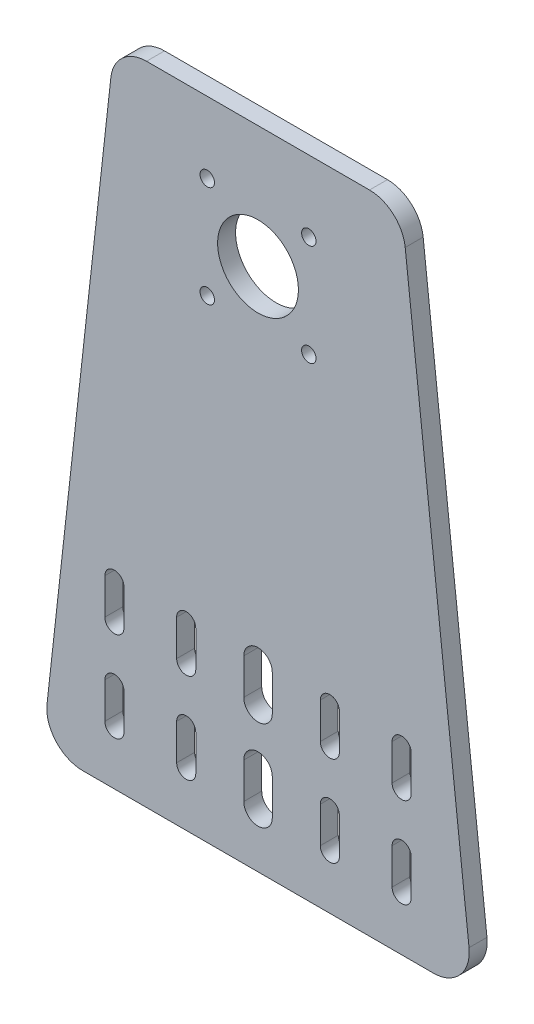
from build123d import *

# Parameters (mm, degrees)
SKETCH1_R           = 14.2875
SKETCH1_R_2         = 2.5527
BOSS_EXTRUDE1_DEPTH = 6.35


with BuildPart() as part:
    # Sketch1 → Boss-Extrude1 (new body)
    with BuildSketch(Plane.XY):
        with BuildLine():
            Line((14.189265695, 0), (138.210734305, 0))
            ThreePointArc((138.210734305, 0), (147.673860132, 4.230097428), (150.833057735, 14.102480381))
            Line((150.833057735, 14.102480381), (128.255279958, 217.302480381))
            ThreePointArc((128.255279958, 217.302480381), (124.102859099, 225.363125827), (115.632956527, 228.6))
            Line((115.632956527, 228.6), (36.767043473, 228.6))
            ThreePointArc((36.767043473, 228.6), (28.297140901, 225.363125827), (24.144720042, 217.302480381))
            Line((24.144720042, 217.302480381), (1.566942265, 14.102480381))
            ThreePointArc((1.566942265, 14.102480381), (4.726139868, 4.230097428), (14.189265695, 0))
        make_face()
        with Locations((76.2, 185.4708)):
            Circle(SKETCH1_R, mode=Mode.SUBTRACT)
        with Locations((94.160512242, 203.431312242)):
            Circle(SKETCH1_R_2, mode=Mode.SUBTRACT)
        with Locations((94.160512242, 167.510287758)):
            Circle(SKETCH1_R_2, mode=Mode.SUBTRACT)
        with Locations((58.239487758, 167.510287758)):
            Circle(SKETCH1_R_2, mode=Mode.SUBTRACT)
        with Locations((58.239487758, 203.431312242)):
            Circle(SKETCH1_R_2, mode=Mode.SUBTRACT)
        with BuildLine():
            Line((98.2218, 19.05), (98.2218, 31.75))
            ThreePointArc((98.2218, 31.75), (101.6, 35.1282), (104.9782, 31.75))
            Line((104.9782, 31.75), (104.9782, 19.05))
            ThreePointArc((104.9782, 19.05), (101.6, 15.6718), (98.2218, 19.05))
        make_face(mode=Mode.SUBTRACT)
        with BuildLine():
            Line((71.1581, 19.05), (71.1581, 31.75))
            ThreePointArc((71.1581, 31.75), (76.2, 36.7919), (81.2419, 31.75))
            Line((81.2419, 31.75), (81.2419, 19.05))
            ThreePointArc((81.2419, 19.05), (76.2, 14.0081), (71.1581, 19.05))
        make_face(mode=Mode.SUBTRACT)
        with BuildLine():
            Line((130.3782, 19.05), (130.3782, 31.75))
            ThreePointArc((130.3782, 31.75), (127, 35.1282), (123.6218, 31.75))
            Line((123.6218, 31.75), (123.6218, 19.05))
            ThreePointArc((123.6218, 19.05), (127, 15.6718), (130.3782, 19.05))
        make_face(mode=Mode.SUBTRACT)
        with BuildLine():
            Line((54.1782, 19.05), (54.1782, 31.75))
            ThreePointArc((54.1782, 31.75), (50.8, 35.1282), (47.4218, 31.75))
            Line((47.4218, 31.75), (47.4218, 19.05))
            ThreePointArc((47.4218, 19.05), (50.8, 15.6718), (54.1782, 19.05))
        make_face(mode=Mode.SUBTRACT)
        with BuildLine():
            Line((28.7782, 19.05), (28.7782, 31.75))
            ThreePointArc((28.7782, 31.75), (25.4, 35.1282), (22.0218, 31.75))
            Line((22.0218, 31.75), (22.0218, 19.05))
            ThreePointArc((22.0218, 19.05), (25.4, 15.6718), (28.7782, 19.05))
        make_face(mode=Mode.SUBTRACT)
        with BuildLine():
            Line((28.7782, 50.9524), (28.7782, 63.6524))
            ThreePointArc((28.7782, 63.6524), (25.4, 67.0306), (22.0218, 63.6524))
            Line((22.0218, 63.6524), (22.0218, 50.9524))
            ThreePointArc((22.0218, 50.9524), (25.4, 47.5742), (28.7782, 50.9524))
        make_face(mode=Mode.SUBTRACT)
        with BuildLine():
            Line((54.1782, 50.9524), (54.1782, 63.6524))
            ThreePointArc((54.1782, 63.6524), (50.8, 67.0306), (47.4218, 63.6524))
            Line((47.4218, 63.6524), (47.4218, 50.9524))
            ThreePointArc((47.4218, 50.9524), (50.8, 47.5742), (54.1782, 50.9524))
        make_face(mode=Mode.SUBTRACT)
        with BuildLine():
            Line((81.2419, 50.9524), (81.2419, 63.6524))
            ThreePointArc((81.2419, 63.6524), (76.2, 68.6943), (71.1581, 63.6524))
            Line((71.1581, 63.6524), (71.1581, 50.9524))
            ThreePointArc((71.1581, 50.9524), (76.2, 45.9105), (81.2419, 50.9524))
        make_face(mode=Mode.SUBTRACT)
        with BuildLine():
            Line((104.9782, 50.9524), (104.9782, 63.6524))
            ThreePointArc((104.9782, 63.6524), (101.6, 67.0306), (98.2218, 63.6524))
            Line((98.2218, 63.6524), (98.2218, 50.9524))
            ThreePointArc((98.2218, 50.9524), (101.6, 47.5742), (104.9782, 50.9524))
        make_face(mode=Mode.SUBTRACT)
        with BuildLine():
            Line((123.6218, 50.9524), (123.6218, 63.6524))
            ThreePointArc((123.6218, 63.6524), (127, 67.0306), (130.3782, 63.6524))
            Line((130.3782, 63.6524), (130.3782, 50.9524))
            ThreePointArc((130.3782, 50.9524), (127, 47.5742), (123.6218, 50.9524))
        make_face(mode=Mode.SUBTRACT)
    extrude(amount=BOSS_EXTRUDE1_DEPTH)


solid = part.part
